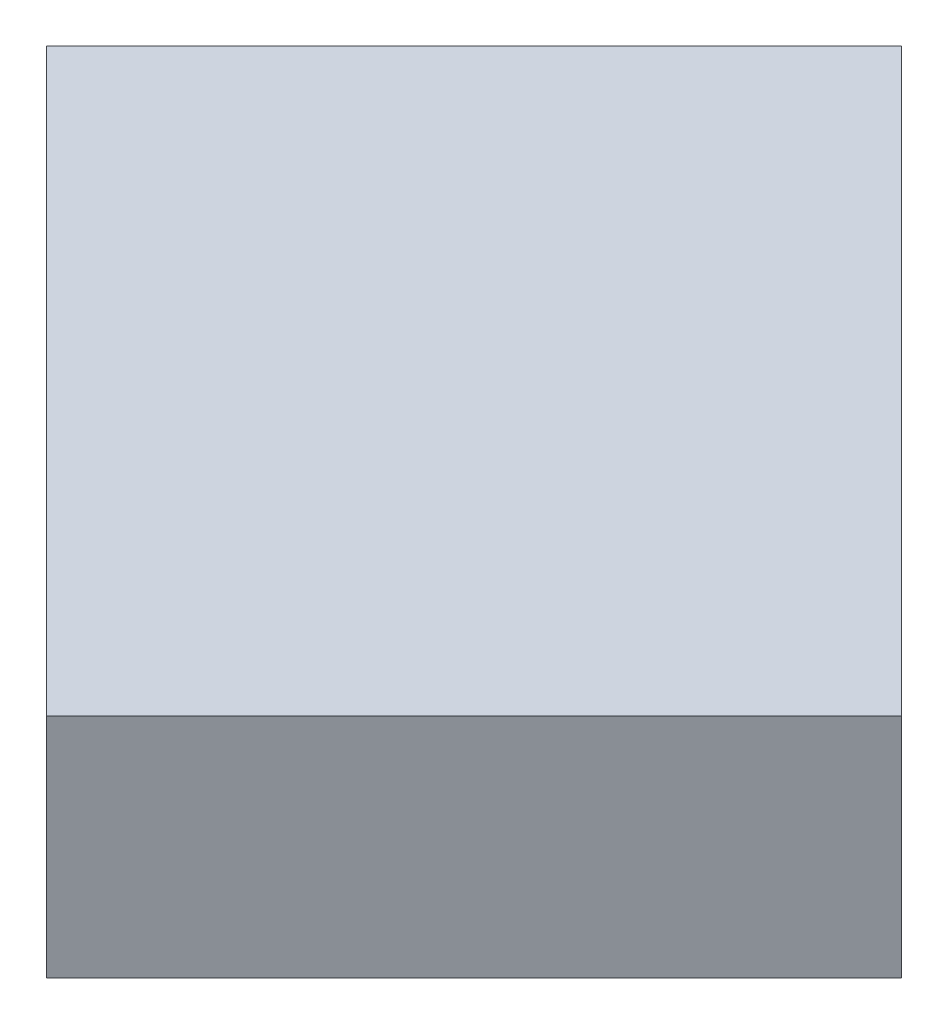
from build123d import *

# Parameters (mm, degrees)
BOSS_EXTRUDE1_DEPTH = 6.62


with BuildPart() as part:
    # Sketch1 → Boss-Extrude1 (new body)
    with BuildSketch(Plane(origin=(0, 0, 0), x_dir=(1, 0, 0), z_dir=(0, 1, 0))):
        Polygon((-2.227386361, 14.707821049), (14.707821049, -2.227386361), (2.227386361, -14.707821049), (-14.707821049, 2.227386361), align=None)
    extrude(amount=BOSS_EXTRUDE1_DEPTH)


solid = part.part
